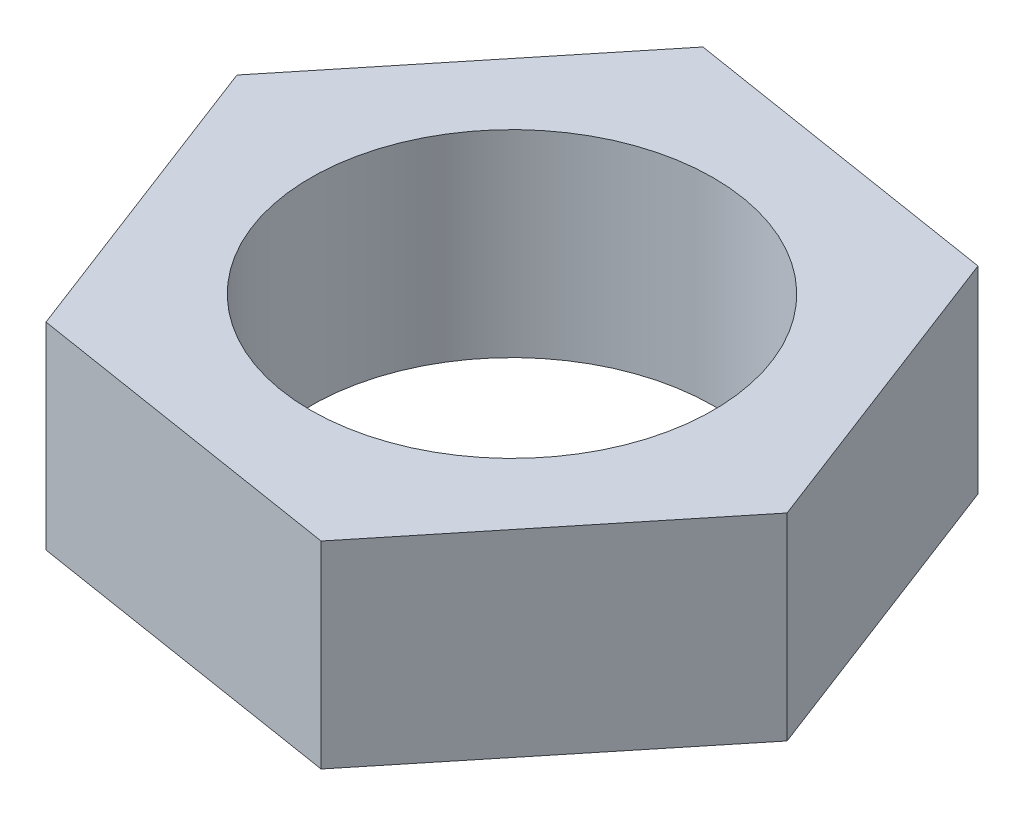
from build123d import *

# Parameters (mm, degrees)
BOSS_EXTRUDE1_DEPTH = 50
SKETCH2_R           = 50.989391982
CUT_EXTRUDE1_DEPTH  = 125.508718894


with BuildPart() as part:
    # Sketch1 → Boss-Extrude1 (new body)
    with BuildSketch(Plane(origin=(0, 0, 0), x_dir=(1, 0, 0), z_dir=(0, 1, 0))):
        Polygon((29.999538639, -78.347009392), (82.850269763, -13.193142133), (52.850731125, 65.153867259), (-29.999538639, 78.347009392), (-82.850269763, 13.193142133), (-52.850731125, -65.153867259), align=None)
    extrude(amount=BOSS_EXTRUDE1_DEPTH)

    # Sketch2 → Cut-Extrude1 (cut, through all)
    with BuildSketch(Plane(origin=(0, 50, 0), x_dir=(1, 0, 0), z_dir=(0, 1, 0))):
        with Locations(Location((0, 0, 0), (0, 0, 270))):
            Circle(SKETCH2_R)
    extrude(amount=-CUT_EXTRUDE1_DEPTH, mode=Mode.SUBTRACT)


solid = part.part
